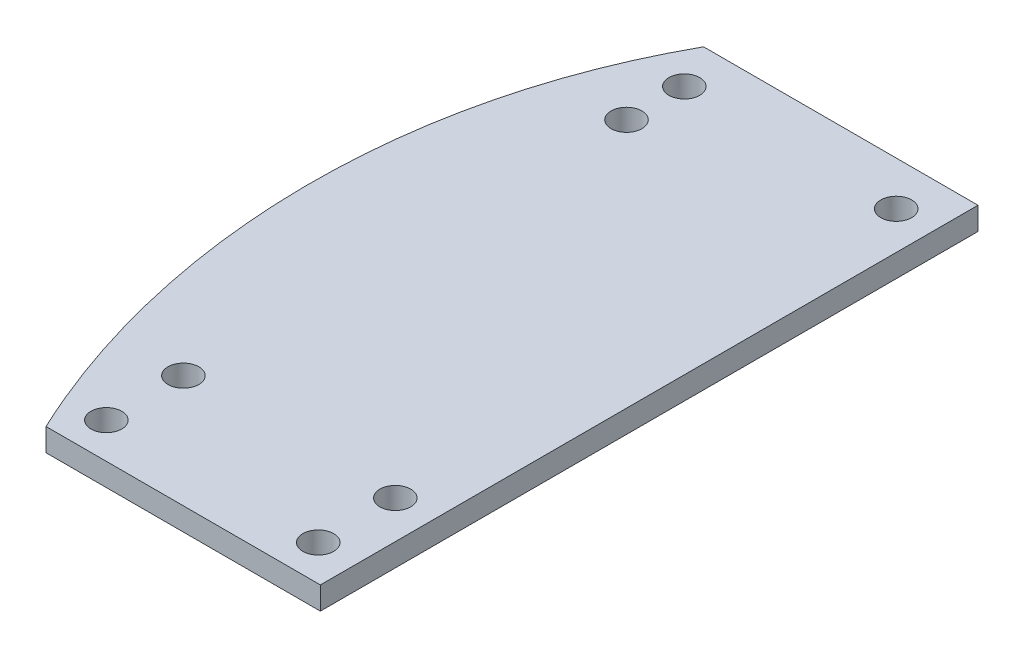
from build123d import *

# Parameters (mm, degrees)
BOSS_EXTRUDE1_DEPTH      = 1
BOSS_EXTRUDE1_DEPTH_BACK = 1.3622
SKETCH15_R               = 1.6
CUT_EXTRUDE1_DEPTH       = 10


with BuildPart() as part:
    # Sketch1 → Boss-Extrude1 (new, two sides: drawn at the far end of the back side and taken through both)
    with BuildSketch(Plane(origin=(0, 0, 0), x_dir=(1, 0, 0), z_dir=(0, 1, 0)).offset(-BOSS_EXTRUDE1_DEPTH_BACK)):
        with BuildLine():
            Line((-8.087993737, -17.857854423), (20.396582526, -17.857854423))
            Line((20.396582526, -17.857854423), (20.396582526, -86.127406927))
            Line((20.396582526, -86.127406927), (-8.087993737, -86.127406927))
            add(Edge.make_bspline(
                [(-8.087993737, -17.857854423), (-19.823523703, -38.981015745), (-18.062835517, -64.98565312), (-8.087993737, -86.127406927)],
                knots=[0, 0, 0, 0, 1, 1, 1, 1], degree=3))
        make_face()
    extrude(amount=BOSS_EXTRUDE1_DEPTH + BOSS_EXTRUDE1_DEPTH_BACK)

    # Sketch15 → Cut-Extrude1 (cut)
    with BuildSketch(Plane(origin=(0, 1, 0), x_dir=(1, 0, 0), z_dir=(0, 1, 0))):
        with Locations(Location((-5.527632766, -22.423505535, 0), (0, 0, 270))):
            Circle(SKETCH15_R)
        with Locations(Location((16.472367234, -22.423505535, 0), (0, 0, 270))):
            Circle(SKETCH15_R)
        with Locations(Location((-5.527632766, -82.423505535, 0), (0, 0, 270))):
            Circle(SKETCH15_R)
        with Locations(Location((16.472367234, -82.423505535, 0), (0, 0, 270))):
            Circle(SKETCH15_R)
        with Locations(Location((-5.527632766, -74.423505535, 0), (0, 0, 270))):
            Circle(SKETCH15_R)
        with Locations(Location((16.472367234, -74.423505535, 0), (0, 0, 270))):
            Circle(SKETCH15_R)
        with Locations(Location((-5.527632766, -28.423505535, 0), (0, 0, 270))):
            Circle(SKETCH15_R)
    extrude(amount=-CUT_EXTRUDE1_DEPTH, mode=Mode.SUBTRACT)


solid = part.part
